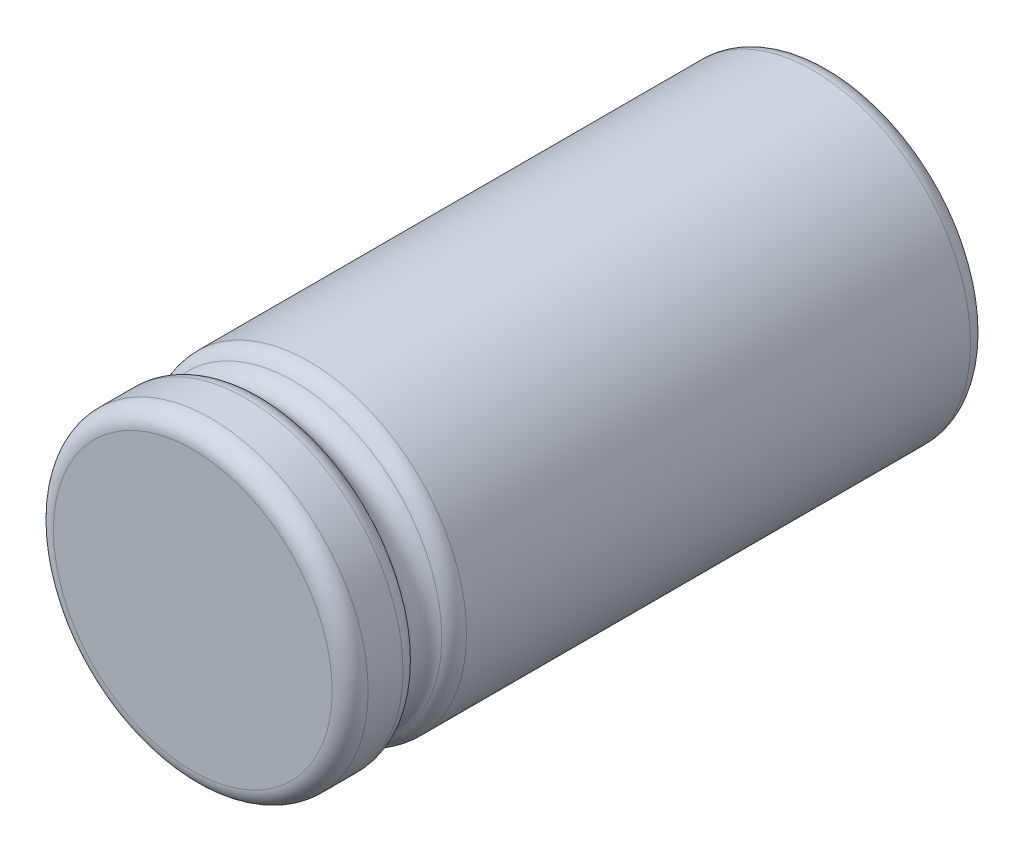
from build123d import *

# Parameters (mm, degrees)
SKETCH1_R           = 17.5
BOSS_EXTRUDE1_DEPTH = 71
FILLET1_R           = 2
SKETCH2_R           = 2.061113782
FILLET2_R           = 2


with BuildPart() as part:
    # Sketch1 → Boss-Extrude1 (new body)
    with BuildSketch(Plane.XY):
        Circle(SKETCH1_R)
    extrude(amount=BOSS_EXTRUDE1_DEPTH)

    # Fillet1
    fillet1_edges = [part.edges().sort_by_distance(p)[0] for p in [
        (-17.5, 0, 0),
        (-17.5, 0, 71),
    ]]
    fillet(fillet1_edges, radius=FILLET1_R)

    # Cut-Sweep1: sweep along a curve in space
    with BuildLine() as cut_sweep1_path:
        ThreePointArc((17.5, 0, 69), (12.374368671, 12.374368671, 69), (0, 17.5, 69))
        ThreePointArc((0, 17.5, 69), (-12.374368671, 12.374368671, 69), (-17.5, 0, 69))
        ThreePointArc((-17.5, 0, 69), (-12.374368671, -12.374368671, 69), (0, -17.5, 69))
        ThreePointArc((0, -17.5, 69), (12.374368671, -12.374368671, 69), (17.5, 0, 69))
    # Sketch2 → Cut-Sweep1 (sweep, cut)
    with BuildSketch(Plane(origin=(0, 0, 0), x_dir=(1, 0, 0), z_dir=(0, 1, 0))):
        with Locations((17.5, -61.590274305)):
            Circle(SKETCH2_R)
    sweep(path=cut_sweep1_path.line, mode=Mode.SUBTRACT)

    # Fillet2
    fillet2_edges = [part.edges().sort_by_distance(p)[0] for p in [
        (-12.374368671, -12.374368671, 63.651388087),
        (12.374368671, -12.374368671, 59.529160523),
    ]]
    fillet(fillet2_edges, radius=FILLET2_R)


solid = part.part
